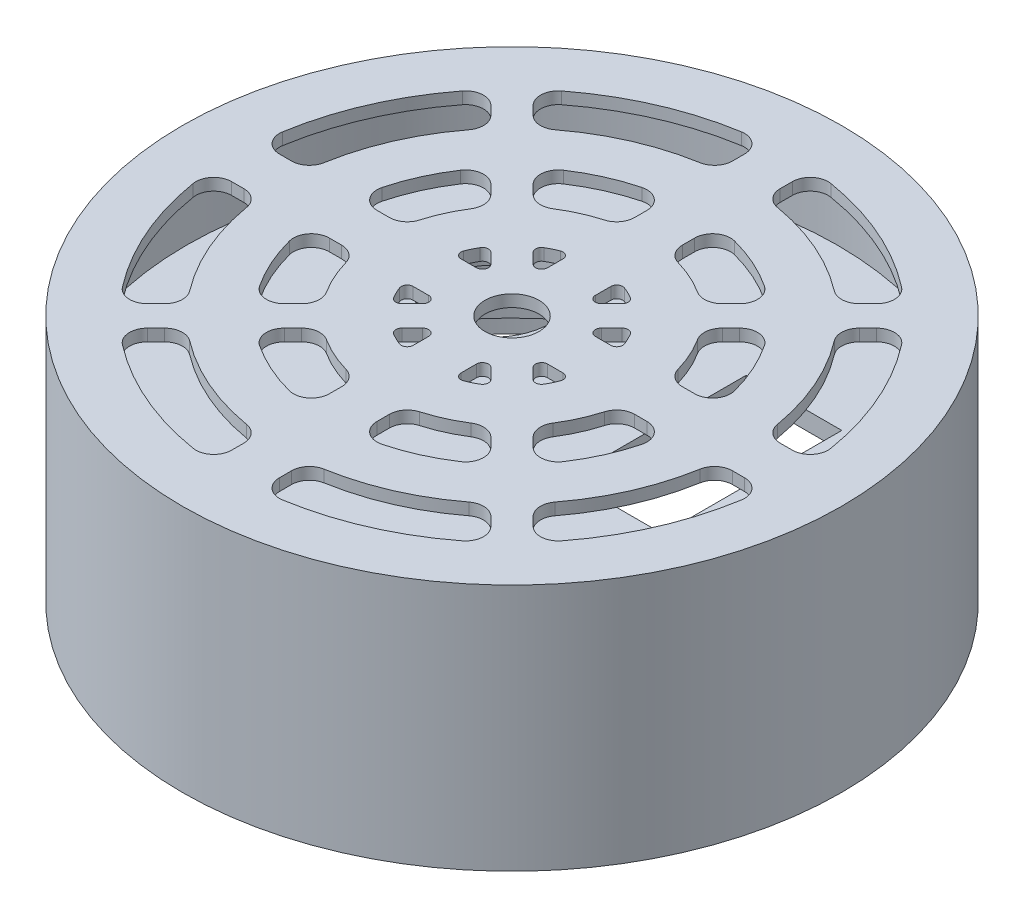
from build123d import *

# Parameters (mm, degrees)
SKETCH1_R           = 55.2
BOSS_EXTRUDE1_DEPTH = 3
SKETCH2_R           = 55
CUT_EXTRUDE1_DEPTH  = 79.12221195
SKETCH4_R           = 55.2
BOSS_EXTRUDE2_DEPTH = 18.5
BOSS_EXTRUDE4_DEPTH = 3
SKETCH6_R           = 55.2
SKETCH6_R_2         = 9.5
SKETCH6_W           = 16
SKETCH6_H           = 30
BOSS_EXTRUDE3_DEPTH = 3
SKETCH9_R           = 55.2
SKETCH9_R_2         = 54.5
BOSS_EXTRUDE5_DEPTH = 15
SKETCH10_R          = 55.2
SKETCH10_R_2        = 4.531369834
BOSS_EXTRUDE6_DEPTH = 2


with BuildPart() as part:
    # Sketch1 → Boss-Extrude1 (new body)
    with BuildSketch(Plane(origin=(0, 0, 0), x_dir=(1, 0, 0), z_dir=(0, 1, 0))):
        with Locations(Location((0, 0, 0), (0, 0, 270))):
            Circle(SKETCH1_R)
    extrude(amount=BOSS_EXTRUDE1_DEPTH)

    # Sketch2 → Cut-Extrude1 (cut, through all)
    with BuildSketch(Plane(origin=(0, 3, 0), x_dir=(1, 0, 0), z_dir=(0, 1, 0))):
        with Locations(Location((0, 0, 0), (0, 0, 270))):
            Circle(SKETCH2_R)
    extrude(amount=-CUT_EXTRUDE1_DEPTH, mode=Mode.SUBTRACT)

    # Sketch4 → Boss-Extrude2 (add)
    with BuildSketch(Plane(origin=(0, 3, 0), x_dir=(1, 0, 0), z_dir=(0, 1, 0))):
        with Locations(Location((0, 0, 0), (0, 0, 270))):
            Circle(SKETCH4_R)
        with BuildLine():
            Line((-45.2, -5), (-45.2, 5))
            Line((-45.2, 5), (-53.768020235, 5))
            ThreePointArc((-53.768020235, 5), (54, 0), (-53.768020235, -5))
            Line((-53.768020235, -5), (-45.2, -5))
        make_face(mode=Mode.SUBTRACT)
    extrude(amount=BOSS_EXTRUDE2_DEPTH)

    # Sketch8 → Boss-Extrude4 (add)
    with BuildSketch(Plane.XZ.offset(-3)):
        with BuildLine():
            Line((-45.2, 5), (-54.772255751, 5))
            ThreePointArc((-54.772255751, 5), (-55, 0), (-54.772255751, -5))
            Line((-54.772255751, -5), (-45.2, -5))
            Line((-45.2, -5), (-45.2, 5))
        make_face()
    extrude(amount=BOSS_EXTRUDE4_DEPTH)

    # Sketch6 → Boss-Extrude3 (add)
    with BuildSketch(Plane(origin=(0, 21.5, 0), x_dir=(1, 0, 0), z_dir=(0, 1, 0))):
        with Locations(Location((0, 0, 0), (0, 0, 270))):
            Circle(SKETCH6_R)
        with Locations(Location((-22.20107336, 19.059873591, 0), (0, 0, 270))):
            Circle(SKETCH6_R_2, mode=Mode.SUBTRACT)
        with Locations((19.213108786, 13)):
            Rectangle(SKETCH6_W, SKETCH6_H, mode=Mode.SUBTRACT)
    extrude(amount=BOSS_EXTRUDE3_DEPTH)

    # Sketch9 → Boss-Extrude5 (add)
    with BuildSketch(Plane(origin=(0, 24.5, 0), x_dir=(1, 0, 0), z_dir=(0, 1, 0))):
        with Locations(Location((0, 0, 0), (0, 0, 270))):
            Circle(SKETCH9_R)
        with Locations(Location((0, 0, 0), (0, 0, 270))):
            Circle(SKETCH9_R_2, mode=Mode.SUBTRACT)
    extrude(amount=BOSS_EXTRUDE5_DEPTH)

    # Sketch10 → Boss-Extrude6 (add)
    with BuildSketch(Plane(origin=(0, 39.5, 0), x_dir=(1, 0, 0), z_dir=(0, 1, 0))):
        with Locations(Location((0, 0, 0), (0, 0, 270))):
            Circle(SKETCH10_R)
        with Locations(Location((0, 0, 0), (0, 0, 270))):
            Circle(SKETCH10_R_2, mode=Mode.SUBTRACT)
        with BuildLine():
            Line((-4, 40.905378619), (-4, 42.933087473))
            ThreePointArc((-4, 42.933087473), (-5.056842243, 45.218724787), (-7.482758621, 45.893990058))
            ThreePointArc((-7.482758621, 45.893990058), (-18.54054336, 42.643853624), (-28.459288433, 36.77388886))
            ThreePointArc((-28.459288433, 36.77388886), (-29.617180258, 34.591416734), (-28.744525652, 32.280059558))
            Line((-28.744525652, 32.280059558), (-27.318312192, 30.853846097))
            ThreePointArc((-27.318312192, 30.853846097), (-25.396226878, 29.981789518), (-23.375522558, 30.591419469))
            ThreePointArc((-23.375522558, 30.591419469), (-15.38108872, 35.294080379), (-6.493975904, 37.948363298))
            ThreePointArc((-6.493975904, 37.948363298), (-4.706741152, 38.971221476), (-4, 40.905378619))
        make_face(mode=Mode.SUBTRACT)
        with BuildLine():
            Line((-4, 24.52039967), (-4, 26.594172294))
            ThreePointArc((-4, 26.594172294), (-5.168458176, 28.970188823), (-7.763636364, 29.495354726))
            ThreePointArc((-7.763636364, 29.495354726), (-12.456434236, 27.840388756), (-16.817668487, 25.444371218))
            ThreePointArc((-16.817668487, 25.444371218), (-18.148280046, 23.243173066), (-17.28479193, 20.820325836))
            Line((-17.28479193, 20.820325836), (-15.839049909, 19.374583815))
            ThreePointArc((-15.839049909, 19.374583815), (-14.043179698, 18.513609369), (-12.103879028, 18.966974257))
            ThreePointArc((-12.103879028, 18.966974257), (-9.237058448, 20.516499488), (-6.176470588, 21.635646768))
            ThreePointArc((-6.176470588, 21.635646768), (-4.60515259, 22.713549958), (-4, 24.52039967))
        make_face(mode=Mode.SUBTRACT)
        with BuildLine():
            Line((-4, 9.949747468), (-4, 12.539936204))
            ThreePointArc((-4, 12.539936204), (-4.438916392, 13.367695339), (-5.37037037, 13.468820367))
            ThreePointArc((-5.37037037, 13.468820367), (-6.323646825, 13.048428673), (-7.244275962, 12.560671391))
            ThreePointArc((-7.244275962, 12.560671391), (-7.736085814, 11.825170316), (-7.451777504, 10.98731141))
            Line((-7.451777504, 10.98731141), (-5.707106781, 9.242640687))
            ThreePointArc((-5.707106781, 9.242640687), (-4.617316568, 9.025867936), (-4, 9.949747468))
        make_face(mode=Mode.SUBTRACT)
        with BuildLine():
            Line((-12.539936204, 4), (-9.949747468, 4))
            ThreePointArc((-9.949747468, 4), (-9.025867936, 4.617316568), (-9.242640687, 5.707106781))
            Line((-9.242640687, 5.707106781), (-10.98731141, 7.451777504))
            ThreePointArc((-10.98731141, 7.451777504), (-11.825170316, 7.736085814), (-12.560671391, 7.244275962))
            ThreePointArc((-12.560671391, 7.244275962), (-13.048428673, 6.323646825), (-13.468820367, 5.37037037))
            ThreePointArc((-13.468820367, 5.37037037), (-13.367695339, 4.438916392), (-12.539936204, 4))
        make_face(mode=Mode.SUBTRACT)
        with BuildLine():
            Line((-26.594172294, 4), (-24.52039967, 4))
            ThreePointArc((-24.52039967, 4), (-22.713549958, 4.60515259), (-21.635646768, 6.176470588))
            ThreePointArc((-21.635646768, 6.176470588), (-20.516499488, 9.237058448), (-18.966974257, 12.103879028))
            ThreePointArc((-18.966974257, 12.103879028), (-18.513609369, 14.043179698), (-19.374583815, 15.839049909))
            Line((-19.374583815, 15.839049909), (-20.820325836, 17.28479193))
            ThreePointArc((-20.820325836, 17.28479193), (-23.243173066, 18.148280046), (-25.444371218, 16.817668487))
            ThreePointArc((-25.444371218, 16.817668487), (-27.840388756, 12.456434236), (-29.495354726, 7.763636364))
            ThreePointArc((-29.495354726, 7.763636364), (-28.970188823, 5.168458176), (-26.594172294, 4))
        make_face(mode=Mode.SUBTRACT)
        with BuildLine():
            Line((-42.933087473, 4), (-40.905378619, 4))
            ThreePointArc((-40.905378619, 4), (-38.971221476, 4.706741152), (-37.948363298, 6.493975904))
            ThreePointArc((-37.948363298, 6.493975904), (-35.294080379, 15.38108872), (-30.591419469, 23.375522558))
            ThreePointArc((-30.591419469, 23.375522558), (-29.981789518, 25.396226878), (-30.853846097, 27.318312192))
            Line((-30.853846097, 27.318312192), (-32.280059558, 28.744525652))
            ThreePointArc((-32.280059558, 28.744525652), (-34.591416734, 29.617180258), (-36.77388886, 28.459288433))
            ThreePointArc((-36.77388886, 28.459288433), (-42.643853624, 18.54054336), (-45.893990058, 7.482758621))
            ThreePointArc((-45.893990058, 7.482758621), (-45.218724787, 5.056842243), (-42.933087473, 4))
        make_face(mode=Mode.SUBTRACT)
        with BuildLine():
            Line((9.242640687, 5.707106781), (10.98731141, 7.451777504))
            ThreePointArc((10.98731141, 7.451777504), (11.825170316, 7.736085814), (12.560671391, 7.244275962))
            ThreePointArc((12.560671391, 7.244275962), (13.048428673, 6.323646825), (13.468820367, 5.37037037))
            ThreePointArc((13.468820367, 5.37037037), (13.367695339, 4.438916392), (12.539936204, 4))
            Line((12.539936204, 4), (9.949747468, 4))
            ThreePointArc((9.949747468, 4), (9.025867936, 4.617316568), (9.242640687, 5.707106781))
        make_face(mode=Mode.SUBTRACT)
        with BuildLine():
            Line((5.707106781, 9.242640687), (7.451777504, 10.98731141))
            ThreePointArc((7.451777504, 10.98731141), (7.736085814, 11.825170316), (7.244275962, 12.560671391))
            ThreePointArc((7.244275962, 12.560671391), (6.323646825, 13.048428673), (5.37037037, 13.468820367))
            ThreePointArc((5.37037037, 13.468820367), (4.438916392, 13.367695339), (4, 12.539936204))
            Line((4, 12.539936204), (4, 9.949747468))
            ThreePointArc((4, 9.949747468), (4.617316568, 9.025867936), (5.707106781, 9.242640687))
        make_face(mode=Mode.SUBTRACT)
        with BuildLine():
            Line((4, 24.52039967), (4, 26.594172294))
            ThreePointArc((4, 26.594172294), (5.168458176, 28.970188823), (7.763636364, 29.495354726))
            ThreePointArc((7.763636364, 29.495354726), (12.456434236, 27.840388756), (16.817668487, 25.444371218))
            ThreePointArc((16.817668487, 25.444371218), (18.148280046, 23.243173066), (17.28479193, 20.820325836))
            Line((17.28479193, 20.820325836), (15.839049909, 19.374583815))
            ThreePointArc((15.839049909, 19.374583815), (14.043179698, 18.513609369), (12.103879028, 18.966974257))
            ThreePointArc((12.103879028, 18.966974257), (9.237058448, 20.516499488), (6.176470588, 21.635646768))
            ThreePointArc((6.176470588, 21.635646768), (4.60515259, 22.713549958), (4, 24.52039967))
        make_face(mode=Mode.SUBTRACT)
        with BuildLine():
            Line((19.374583815, 15.839049909), (20.820325836, 17.28479193))
            ThreePointArc((20.820325836, 17.28479193), (23.243173066, 18.148280046), (25.444371218, 16.817668487))
            ThreePointArc((25.444371218, 16.817668487), (27.840388756, 12.456434236), (29.495354726, 7.763636364))
            ThreePointArc((29.495354726, 7.763636364), (28.970188823, 5.168458176), (26.594172294, 4))
            Line((26.594172294, 4), (24.52039967, 4))
            ThreePointArc((24.52039967, 4), (22.713549958, 4.60515259), (21.635646768, 6.176470588))
            ThreePointArc((21.635646768, 6.176470588), (20.516499488, 9.237058448), (18.966974257, 12.103879028))
            ThreePointArc((18.966974257, 12.103879028), (18.513609369, 14.043179698), (19.374583815, 15.839049909))
        make_face(mode=Mode.SUBTRACT)
        with BuildLine():
            Line((42.933087473, 4), (40.905378619, 4))
            ThreePointArc((40.905378619, 4), (38.971221476, 4.706741152), (37.948363298, 6.493975904))
            ThreePointArc((37.948363298, 6.493975904), (35.294080379, 15.38108872), (30.591419469, 23.375522558))
            ThreePointArc((30.591419469, 23.375522558), (29.981789518, 25.396226878), (30.853846097, 27.318312192))
            Line((30.853846097, 27.318312192), (32.280059558, 28.744525652))
            ThreePointArc((32.280059558, 28.744525652), (34.591416734, 29.617180258), (36.77388886, 28.459288433))
            ThreePointArc((36.77388886, 28.459288433), (42.643853624, 18.54054336), (45.893990058, 7.482758621))
            ThreePointArc((45.893990058, 7.482758621), (45.218724787, 5.056842243), (42.933087473, 4))
        make_face(mode=Mode.SUBTRACT)
        with BuildLine():
            Line((4, 40.905378619), (4, 42.933087473))
            ThreePointArc((4, 42.933087473), (5.056842243, 45.218724787), (7.482758621, 45.893990058))
            ThreePointArc((7.482758621, 45.893990058), (18.54054336, 42.643853624), (28.459288433, 36.77388886))
            ThreePointArc((28.459288433, 36.77388886), (29.617180258, 34.591416734), (28.744525652, 32.280059558))
            Line((28.744525652, 32.280059558), (27.318312192, 30.853846097))
            ThreePointArc((27.318312192, 30.853846097), (25.396226878, 29.981789518), (23.375522558, 30.591419469))
            ThreePointArc((23.375522558, 30.591419469), (15.38108872, 35.294080379), (6.493975904, 37.948363298))
            ThreePointArc((6.493975904, 37.948363298), (4.706741152, 38.971221476), (4, 40.905378619))
        make_face(mode=Mode.SUBTRACT)
        with BuildLine():
            Line((30.853846097, -27.318312192), (32.280059558, -28.744525652))
            ThreePointArc((32.280059558, -28.744525652), (34.591416734, -29.617180258), (36.77388886, -28.459288433))
            ThreePointArc((36.77388886, -28.459288433), (42.643853624, -18.54054336), (45.893990058, -7.482758621))
            ThreePointArc((45.893990058, -7.482758621), (45.218724787, -5.056842243), (42.933087473, -4))
            Line((42.933087473, -4), (40.905378619, -4))
            ThreePointArc((40.905378619, -4), (38.971221476, -4.706741152), (37.948363298, -6.493975904))
            ThreePointArc((37.948363298, -6.493975904), (35.294080379, -15.38108872), (30.591419469, -23.375522558))
            ThreePointArc((30.591419469, -23.375522558), (29.981789518, -25.396226878), (30.853846097, -27.318312192))
        make_face(mode=Mode.SUBTRACT)
        with BuildLine():
            Line((26.594172294, -4), (24.52039967, -4))
            ThreePointArc((24.52039967, -4), (22.713549958, -4.60515259), (21.635646768, -6.176470588))
            ThreePointArc((21.635646768, -6.176470588), (20.516499488, -9.237058448), (18.966974257, -12.103879028))
            ThreePointArc((18.966974257, -12.103879028), (18.513609369, -14.043179698), (19.374583815, -15.839049909))
            Line((19.374583815, -15.839049909), (20.820325836, -17.28479193))
            ThreePointArc((20.820325836, -17.28479193), (23.243173066, -18.148280046), (25.444371218, -16.817668487))
            ThreePointArc((25.444371218, -16.817668487), (27.840388756, -12.456434236), (29.495354726, -7.763636364))
            ThreePointArc((29.495354726, -7.763636364), (28.970188823, -5.168458176), (26.594172294, -4))
        make_face(mode=Mode.SUBTRACT)
        with BuildLine():
            Line((9.242640687, -5.707106781), (10.98731141, -7.451777504))
            ThreePointArc((10.98731141, -7.451777504), (11.825170316, -7.736085814), (12.560671391, -7.244275962))
            ThreePointArc((12.560671391, -7.244275962), (13.048428673, -6.323646825), (13.468820367, -5.37037037))
            ThreePointArc((13.468820367, -5.37037037), (13.367695339, -4.438916392), (12.539936204, -4))
            Line((12.539936204, -4), (9.949747468, -4))
            ThreePointArc((9.949747468, -4), (9.025867936, -4.617316568), (9.242640687, -5.707106781))
        make_face(mode=Mode.SUBTRACT)
        with BuildLine():
            Line((-9.242640687, -5.707106781), (-10.98731141, -7.451777504))
            ThreePointArc((-10.98731141, -7.451777504), (-11.825170316, -7.736085814), (-12.560671391, -7.244275962))
            ThreePointArc((-12.560671391, -7.244275962), (-13.048428673, -6.323646825), (-13.468820367, -5.37037037))
            ThreePointArc((-13.468820367, -5.37037037), (-13.367695339, -4.438916392), (-12.539936204, -4))
            Line((-12.539936204, -4), (-9.949747468, -4))
            ThreePointArc((-9.949747468, -4), (-9.025867936, -4.617316568), (-9.242640687, -5.707106781))
        make_face(mode=Mode.SUBTRACT)
        with BuildLine():
            Line((-5.707106781, -9.242640687), (-7.451777504, -10.98731141))
            ThreePointArc((-7.451777504, -10.98731141), (-7.736085814, -11.825170316), (-7.244275962, -12.560671391))
            ThreePointArc((-7.244275962, -12.560671391), (-6.323646825, -13.048428673), (-5.37037037, -13.468820367))
            ThreePointArc((-5.37037037, -13.468820367), (-4.438916392, -13.367695339), (-4, -12.539936204))
            Line((-4, -12.539936204), (-4, -9.949747468))
            ThreePointArc((-4, -9.949747468), (-4.617316568, -9.025867936), (-5.707106781, -9.242640687))
        make_face(mode=Mode.SUBTRACT)
        with BuildLine():
            Line((4, -9.949747468), (4, -12.539936204))
            ThreePointArc((4, -12.539936204), (4.438916392, -13.367695339), (5.37037037, -13.468820367))
            ThreePointArc((5.37037037, -13.468820367), (6.323646825, -13.048428673), (7.244275962, -12.560671391))
            ThreePointArc((7.244275962, -12.560671391), (7.736085814, -11.825170316), (7.451777504, -10.98731141))
            Line((7.451777504, -10.98731141), (5.707106781, -9.242640687))
            ThreePointArc((5.707106781, -9.242640687), (4.617316568, -9.025867936), (4, -9.949747468))
        make_face(mode=Mode.SUBTRACT)
        with BuildLine():
            Line((4, -24.52039967), (4, -26.594172294))
            ThreePointArc((4, -26.594172294), (5.168458176, -28.970188823), (7.763636364, -29.495354726))
            ThreePointArc((7.763636364, -29.495354726), (12.456434236, -27.840388756), (16.817668487, -25.444371218))
            ThreePointArc((16.817668487, -25.444371218), (18.148280046, -23.243173066), (17.28479193, -20.820325836))
            Line((17.28479193, -20.820325836), (15.839049909, -19.374583815))
            ThreePointArc((15.839049909, -19.374583815), (14.043179698, -18.513609369), (12.103879028, -18.966974257))
            ThreePointArc((12.103879028, -18.966974257), (9.237058448, -20.516499488), (6.176470588, -21.635646768))
            ThreePointArc((6.176470588, -21.635646768), (4.60515259, -22.713549958), (4, -24.52039967))
        make_face(mode=Mode.SUBTRACT)
        with BuildLine():
            Line((4, -40.905378619), (4, -42.933087473))
            ThreePointArc((4, -42.933087473), (5.056842243, -45.218724787), (7.482758621, -45.893990058))
            ThreePointArc((7.482758621, -45.893990058), (18.54054336, -42.643853624), (28.459288433, -36.77388886))
            ThreePointArc((28.459288433, -36.77388886), (29.617180258, -34.591416734), (28.744525652, -32.280059558))
            Line((28.744525652, -32.280059558), (27.318312192, -30.853846097))
            ThreePointArc((27.318312192, -30.853846097), (25.396226878, -29.981789518), (23.375522558, -30.591419469))
            ThreePointArc((23.375522558, -30.591419469), (15.38108872, -35.294080379), (6.493975904, -37.948363298))
            ThreePointArc((6.493975904, -37.948363298), (4.706741152, -38.971221476), (4, -40.905378619))
        make_face(mode=Mode.SUBTRACT)
        with BuildLine():
            Line((-4, -24.52039967), (-4, -26.594172294))
            ThreePointArc((-4, -26.594172294), (-5.168458176, -28.970188823), (-7.763636364, -29.495354726))
            ThreePointArc((-7.763636364, -29.495354726), (-12.456434236, -27.840388756), (-16.817668487, -25.444371218))
            ThreePointArc((-16.817668487, -25.444371218), (-18.148280046, -23.243173066), (-17.28479193, -20.820325836))
            Line((-17.28479193, -20.820325836), (-15.839049909, -19.374583815))
            ThreePointArc((-15.839049909, -19.374583815), (-14.043179698, -18.513609369), (-12.103879028, -18.966974257))
            ThreePointArc((-12.103879028, -18.966974257), (-9.237058448, -20.516499488), (-6.176470588, -21.635646768))
            ThreePointArc((-6.176470588, -21.635646768), (-4.60515259, -22.713549958), (-4, -24.52039967))
        make_face(mode=Mode.SUBTRACT)
        with BuildLine():
            Line((-19.374583815, -15.839049909), (-20.820325836, -17.28479193))
            ThreePointArc((-20.820325836, -17.28479193), (-23.243173066, -18.148280046), (-25.444371218, -16.817668487))
            ThreePointArc((-25.444371218, -16.817668487), (-27.840388756, -12.456434236), (-29.495354726, -7.763636364))
            ThreePointArc((-29.495354726, -7.763636364), (-28.970188823, -5.168458176), (-26.594172294, -4))
            Line((-26.594172294, -4), (-24.52039967, -4))
            ThreePointArc((-24.52039967, -4), (-22.713549958, -4.60515259), (-21.635646768, -6.176470588))
            ThreePointArc((-21.635646768, -6.176470588), (-20.516499488, -9.237058448), (-18.966974257, -12.103879028))
            ThreePointArc((-18.966974257, -12.103879028), (-18.513609369, -14.043179698), (-19.374583815, -15.839049909))
        make_face(mode=Mode.SUBTRACT)
        with BuildLine():
            Line((-42.933087473, -4), (-40.905378619, -4))
            ThreePointArc((-40.905378619, -4), (-38.971221476, -4.706741152), (-37.948363298, -6.493975904))
            ThreePointArc((-37.948363298, -6.493975904), (-35.294080379, -15.38108872), (-30.591419469, -23.375522558))
            ThreePointArc((-30.591419469, -23.375522558), (-29.981789518, -25.396226878), (-30.853846097, -27.318312192))
            Line((-30.853846097, -27.318312192), (-32.280059558, -28.744525652))
            ThreePointArc((-32.280059558, -28.744525652), (-34.591416734, -29.617180258), (-36.77388886, -28.459288433))
            ThreePointArc((-36.77388886, -28.459288433), (-42.643853624, -18.54054336), (-45.893990058, -7.482758621))
            ThreePointArc((-45.893990058, -7.482758621), (-45.218724787, -5.056842243), (-42.933087473, -4))
        make_face(mode=Mode.SUBTRACT)
        with BuildLine():
            Line((-4, -40.905378619), (-4, -42.933087473))
            ThreePointArc((-4, -42.933087473), (-5.056842243, -45.218724787), (-7.482758621, -45.893990058))
            ThreePointArc((-7.482758621, -45.893990058), (-18.54054336, -42.643853624), (-28.459288433, -36.77388886))
            ThreePointArc((-28.459288433, -36.77388886), (-29.617180258, -34.591416734), (-28.744525652, -32.280059558))
            Line((-28.744525652, -32.280059558), (-27.318312192, -30.853846097))
            ThreePointArc((-27.318312192, -30.853846097), (-25.396226878, -29.981789518), (-23.375522558, -30.591419469))
            ThreePointArc((-23.375522558, -30.591419469), (-15.38108872, -35.294080379), (-6.493975904, -37.948363298))
            ThreePointArc((-6.493975904, -37.948363298), (-4.706741152, -38.971221476), (-4, -40.905378619))
        make_face(mode=Mode.SUBTRACT)
    extrude(amount=BOSS_EXTRUDE6_DEPTH)


solid = part.part
